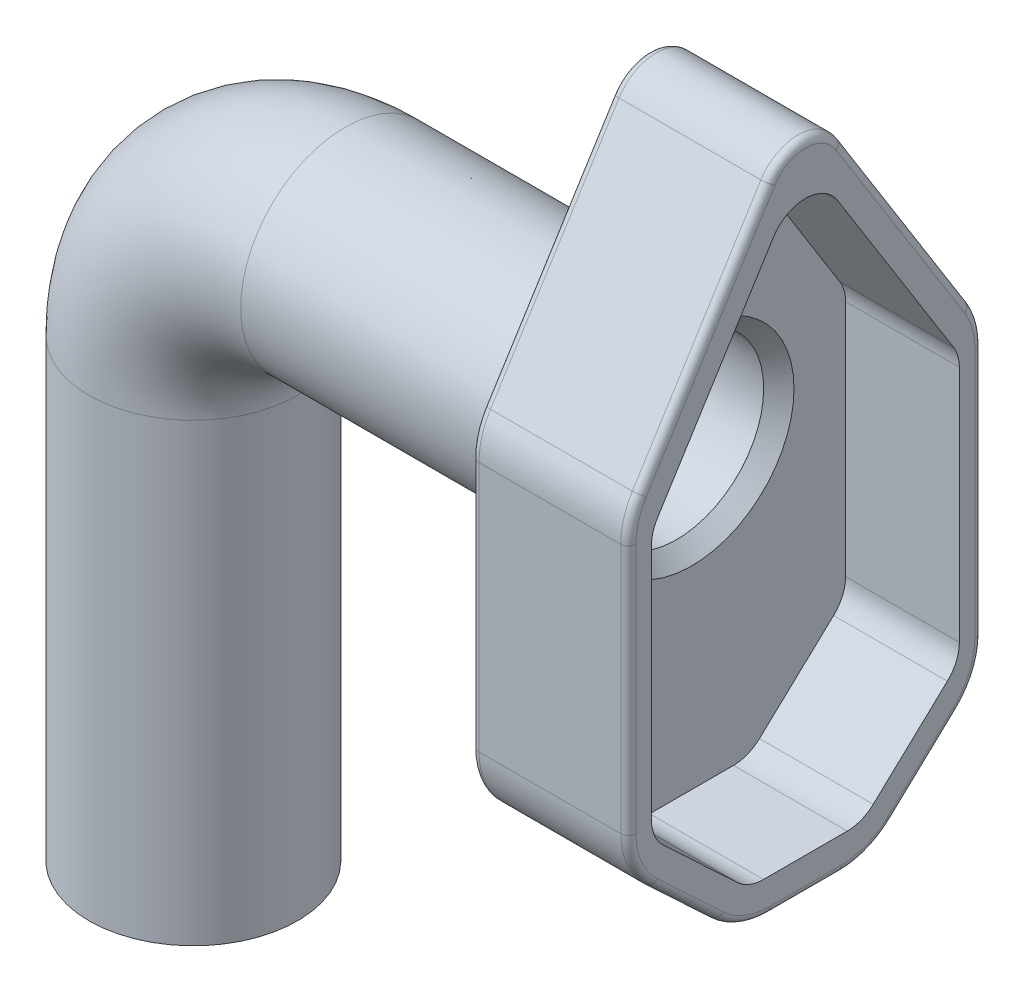
from build123d import *

# Parameters (mm, degrees)
BOSS_EXTRUDE1_DEPTH  = 18
SCALE1_SCALE         = 1.15
CUT_EXTRUDE1_DEPTH   = 15
FILLET1_R            = 10
FILLET2_R            = 5
FILLET3_R            = 1
FILLET4_R            = 1
SKETCH9_R            = 11.5
CUT_EXTRUDE2_DEPTH   = 72.03051567
CHAMFER1_SIZE        = 2
SWEEP1_PROFILE_R     = 13.75
CUT_SWEEP2_PROFILE_R = 11.5
SKETCH13_W           = 4.77632411
SKETCH13_H           = 5.487691531
CUT_EXTRUDE3_DEPTH   = 10
SKETCH16_W           = 12.563431947
SKETCH16_H           = 4.070574999
CUT_EXTRUDE5_DEPTH   = 3


with BuildPart() as part:
    # Sketch1 → Boss-Extrude1 (new body)
    with BuildSketch(Plane.YZ):
        with BuildLine():
            Line((-35, -40.6), (0, -40.6))
            Line((0, -40.6), (25.653410767, -24.537854564))
            ThreePointArc((25.653410767, -24.537854564), (28, -20.3), (25.653410767, -16.062145436))
            Line((25.653410767, -16.062145436), (0, 0))
            Line((0, 0), (-35, 0))
            Line((-35, 0), (-47, -12.8))
            Line((-47, -12.8), (-47, -27.8))
            Line((-47, -27.8), (-35, -40.6))
        make_face()
    extrude(amount=BOSS_EXTRUDE1_DEPTH)


with BuildPart() as part_1:
    # Scale1: scaled about (9, -13.156905102, -20.3)
    add(part.part.scale(SCALE1_SCALE).moved(Location((-1.35, 1.973535765, 3.045))))

    # Sketch7 → Cut-Extrude1 (cut)
    with BuildSketch(Plane.YZ.offset(19.35)):
        with BuildLine():
            Line((-35.576464235, -40.6), (-0.576464235, -40.6))
            Line((-0.576464235, -40.6), (25.076946532, -24.537854564))
            ThreePointArc((25.076946532, -24.537854564), (27.423535765, -20.3), (25.076946532, -16.062145436))
            Line((25.076946532, -16.062145436), (-0.576464235, 0))
            Line((-0.576464235, 0), (-35.576464235, 0))
            Line((-35.576464235, 0), (-47.576464235, -12.8))
            Line((-47.576464235, -12.8), (-47.576464235, -27.8))
            Line((-47.576464235, -27.8), (-35.576464235, -40.6))
        make_face()
    extrude(amount=-CUT_EXTRUDE1_DEPTH, mode=Mode.SUBTRACT)

    # Fillet1
    fillet1_edges = [part_1.edges().sort_by_distance(p)[0] for p in [
        (9, 1.973535765, 3.045),
        (9, -38.276464235, 3.045),
        (9, -52.076464235, -11.675),
        (9, -52.076464235, -28.925),
        (9, 1.973535765, -43.645),
        (9, -38.276464235, -43.645),
    ]]
    fillet(fillet1_edges, radius=FILLET1_R)

    # Fillet2
    fillet2_edges = [part_1.edges().sort_by_distance(p)[0] for p in [
        (11.85, -0.576464235, -40.6),
        (11.85, -35.576464235, -40.6),
        (11.85, -47.576464235, -27.8),
        (11.85, -47.576464235, -12.8),
        (11.85, -0.576464235, 0),
        (11.85, -35.576464235, 0),
    ]]
    fillet(fillet2_edges, radius=FILLET2_R)

    # Fillet3
    fillet3_edges = [part_1.edges().sort_by_distance(p)[0] for p in [
        (19.35, -45.305676214, -36.147173889),
        (19.35, -51.375757767, -28.647907393),
        (19.35, -52.076464235, -20.3),
        (19.35, -51.375757767, -11.952092607),
        (19.35, -45.305676214, -4.452826111),
        (19.35, -37.919435742, 2.220895403),
        (19.35, -17.421465972, 3.045),
        (19.35, 1.861910332, 2.656375845),
        (19.35, 17.941495924, -6.952879062),
        (19.35, 34.173535765, -20.3),
        (19.35, 17.941495924, -33.647120938),
        (19.35, 1.861910332, -43.256375845),
        (19.35, -17.421465972, -43.645),
        (19.35, -37.919435742, -42.820895403),
    ]]
    fillet(fillet3_edges, radius=FILLET3_R)

    # Fillet4
    fillet4_edges = [part_1.edges().sort_by_distance(p)[0] for p in [
        (-1.35, 1.861910332, -43.256375845),
        (-1.35, 17.941495924, -33.647120938),
        (-1.35, 34.173535765, -20.3),
        (-1.35, 17.941495924, -6.952879062),
        (-1.35, 1.861910332, 2.656375845),
        (-1.35, -17.421465972, 3.045),
        (-1.35, -37.919435742, 2.220895403),
        (-1.35, -45.305676214, -4.452826111),
        (-1.35, -51.375757767, -11.952092607),
        (-1.35, -52.076464235, -20.3),
        (-1.35, -51.375757767, -28.647907393),
        (-1.35, -45.305676214, -36.147173889),
        (-1.35, -37.919435742, -42.820895403),
        (-1.35, -17.421465972, -43.645),
    ]]
    fillet(fillet4_edges, radius=FILLET4_R)

    # Sketch9 → Cut-Extrude2 (cut, through all)
    with BuildSketch(Plane(origin=(-1.35, 0, 0), x_dir=(0, -1, 0), z_dir=(-1, 0, 0))):
        with Locations((8.54339023, -20.3)):
            Circle(SKETCH9_R)
    extrude(amount=-CUT_EXTRUDE2_DEPTH, mode=Mode.SUBTRACT)

    # Chamfer1
    chamfer1_edges = [part_1.edges().sort_by_distance(p)[0] for p in [
        (4.35, 2.95660977, -20.3),
    ]]
    chamfer(chamfer1_edges, length=CHAMFER1_SIZE)

    # Sweep1: sweep along a path in Sketch11
    with BuildLine(Plane.XY.offset(-20.3)) as sweep1_path:
        Line((-1.35, -8.54339023), (-41.35, -8.54339023))
        ThreePointArc((-41.35, -8.54339023), (-55.492135624, -14.401254607), (-61.35, -28.54339023))
        Line((-61.35, -28.54339023), (-61.35, -88.54339023))
    # Sweep1 profile (on start of the path) → Sweep1 (sweep)
    with BuildSketch(Plane(origin=(-1.35, -8.54339023, -20.3), x_dir=(0, -1, 0), z_dir=(-1, 0, 0))):
        Circle(SWEEP1_PROFILE_R)
    sweep(path=sweep1_path.line)

    # Cut-Sweep2: sweep along a path in Sketch11<3>
    with BuildLine(Plane.XY.offset(-20.3)) as cut_sweep2_path:
        Line((-1.35, -8.54339023), (-41.35, -8.54339023))
        ThreePointArc((-41.35, -8.54339023), (-55.492135624, -14.401254607), (-61.35, -28.54339023))
        Line((-61.35, -28.54339023), (-61.35, -88.54339023))
    # Cut-Sweep2 profile (on start of the path) → Cut-Sweep2 (sweep, cut)
    with BuildSketch(Plane(origin=(-1.35, -8.54339023, -20.3), x_dir=(0, -1, 0), z_dir=(-1, 0, 0))):
        Circle(CUT_SWEEP2_PROFILE_R)
    sweep(path=cut_sweep2_path.line, mode=Mode.SUBTRACT)

    # Sketch13 → Cut-Extrude3 (cut)
    with BuildSketch(Plane.XZ.offset(88.54339023)):
        with Locations((-61.35, -29.344528634)):
            Rectangle(SKETCH13_W, SKETCH13_H)
    extrude(amount=-CUT_EXTRUDE3_DEPTH, mode=Mode.SUBTRACT)

    # Sketch16 → Cut-Extrude5 (cut)
    with BuildSketch(Plane.YZ.offset(-63.738162055)):
        with Locations((-84.825106204, -30.0530869)):
            Rectangle(SKETCH16_W, SKETCH16_H)
    extrude(amount=-CUT_EXTRUDE5_DEPTH, mode=Mode.SUBTRACT)


solid = part_1.part
